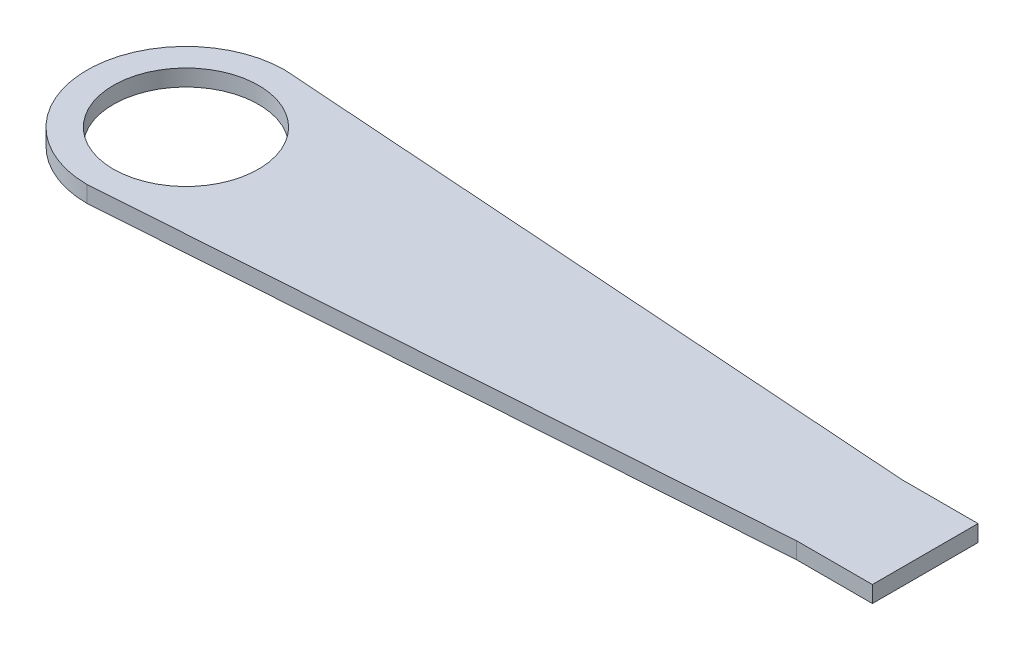
from build123d import *

# Parameters (mm, degrees)
SKETCH1_W           = 1.152195829
SKETCH1_H           = 1.6
BOSS_EXTRUDE3_DEPTH = 0.25


with BuildPart() as part:
    # Sketch1 → Boss-Extrude3 (new body)
    with BuildSketch(Plane(origin=(0, 0, 0), x_dir=(1, 0, 0), z_dir=(0, 1, 0))):
        with BuildLine():
            Line((-2.942295951, 1.981055848), (-3.150287356, 1.995545977))
            ThreePointArc((-3.150287356, 1.995545977), (-3.874856194, 1.808938531), (-4.41914511, 1.295545977))
            Line((-4.41914511, 1.295545977), (-3.9052708, 1.295545977))
            ThreePointArc((-3.9052708, 1.295545977), (-3.150287356, 1.595545977), (-2.395303913, 1.295545977))
            Line((-2.395303913, 1.295545977), (-1.881429602, 1.295545977))
            ThreePointArc((-1.881429602, 1.295545977), (-2.336191658, 1.755406364), (-2.942295951, 1.981055848))
        make_face()
        with BuildLine():
            Line((6.897516815, 1.295545977), (-2.942295951, 1.981055848))
            ThreePointArc((-2.942295951, 1.981055848), (-2.336191658, 1.755406364), (-1.881429602, 1.295545977))
            Line((-1.881429602, 1.295545977), (6.897516815, 1.295545977))
        make_face()
        with BuildLine():
            Line((-3.9052708, 1.295545977), (-4.41914511, 1.295545977))
            ThreePointArc((-4.41914511, 1.295545977), (-4.591343676, 0.91190722), (-4.650287356, 0.495545977))
            ThreePointArc((-4.650287356, 0.495545977), (-4.591343676, 0.079184734), (-4.41914511, -0.304454023))
            Line((-4.41914511, -0.304454023), (-3.9052708, -0.304454023))
            ThreePointArc((-3.9052708, -0.304454023), (-4.250287356, 0.495545977), (-3.9052708, 1.295545977))
        make_face()
        with BuildLine():
            ThreePointArc((-1.650287356, 0.495545977), (-1.709231037, 0.91190722), (-1.881429602, 1.295545977))
            Line((-1.881429602, 1.295545977), (-2.395303913, 1.295545977))
            ThreePointArc((-2.395303913, 1.295545977), (-2.140217609, 0.931159459), (-2.050287356, 0.495545977))
            ThreePointArc((-2.050287356, 0.495545977), (-2.140217609, 0.059932495), (-2.395303913, -0.304454023))
            Line((-2.395303913, -0.304454023), (-1.881429602, -0.304454023))
            ThreePointArc((-1.881429602, -0.304454023), (-1.709231037, 0.079184734), (-1.650287356, 0.495545977))
        make_face()
        with BuildLine():
            ThreePointArc((-2.395303913, -0.304454023), (-3.150287356, -0.604454023), (-3.9052708, -0.304454023))
            Line((-3.9052708, -0.304454023), (-4.41914511, -0.304454023))
            ThreePointArc((-4.41914511, -0.304454023), (-3.874856194, -0.817846577), (-3.150287356, -1.004454023))
            Line((-3.150287356, -1.004454023), (-2.942295951, -0.989963893))
            ThreePointArc((-2.942295951, -0.989963893), (-2.336191658, -0.76431441), (-1.881429602, -0.304454023))
            Line((-1.881429602, -0.304454023), (-2.395303913, -0.304454023))
        make_face()
        with BuildLine():
            Line((6.897516815, -0.304454023), (6.897516815, 1.295545977))
            Line((6.897516815, 1.295545977), (-1.881429602, 1.295545977))
            ThreePointArc((-1.881429602, 1.295545977), (-1.709231037, 0.91190722), (-1.650287356, 0.495545977))
            ThreePointArc((-1.650287356, 0.495545977), (-1.709231037, 0.079184734), (-1.881429602, -0.304454023))
            Line((-1.881429602, -0.304454023), (6.897516815, -0.304454023))
        make_face()
        with BuildLine():
            Line((-2.942295951, -0.989963893), (6.897516815, -0.304454023))
            Line((6.897516815, -0.304454023), (-1.881429602, -0.304454023))
            ThreePointArc((-1.881429602, -0.304454023), (-2.336191658, -0.76431441), (-2.942295951, -0.989963893))
        make_face()
        with Locations((7.47361473, 0.495545977)):
            Rectangle(SKETCH1_W, SKETCH1_H)
    extrude(amount=BOSS_EXTRUDE3_DEPTH)


solid = part.part
